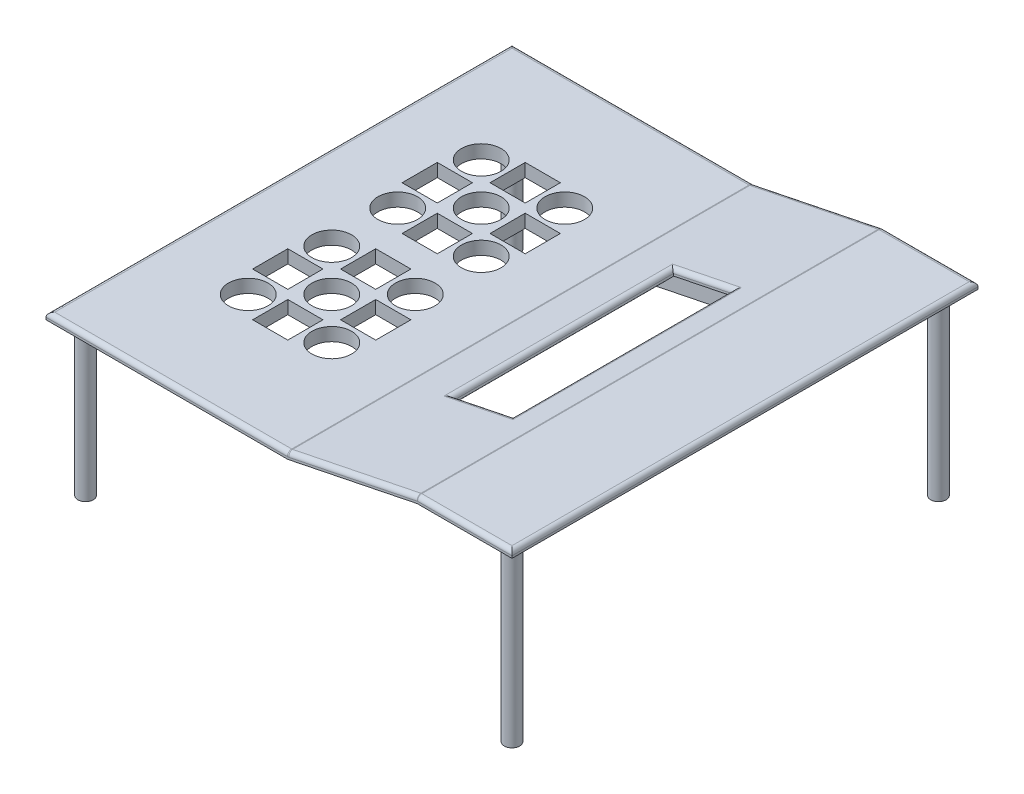
from build123d import *

# Parameters (mm, degrees)
EXTRUDE_1_DEPTH     = 106
SKETCH_4_R          = 1.75
EXTRUDE_2_DEPTH     = 34.6
SKETCH_5_R          = 1.75
EXTRUDE_3_DEPTH     = 40.6
SKETCH_8_W          = 30
SKETCH_8_H          = 60
EXTRUDE_4_DEPTH     = 3.5
SKETCH_9_W          = 26
SKETCH_9_H          = 51
CUT_EXTRUDE_1_DEPTH = 1.5
SKETCH_10_W         = 17
SKETCH_10_H         = 51
CUT_EXTRUDE_2_DEPTH = 2
CUT_EXTRUDE_4_REACH = 152.505
SKETCH_11_W         = 14
SKETCH_11_H         = 50
FILLET_3_R          = 1
FILLET_4_R          = 1
SKETCH_13_W         = 51
SKETCH_13_H         = 76
EXTRUDE_5_DEPTH     = 3.5
SKETCH_14_W         = 50
SKETCH_14_H         = 72
CUT_EXTRUDE_5_DEPTH = 2
CUT_EXTRUDE_7_REACH = 156.192
SKETCH_15_R         = 4.5
SKETCH_15_W         = 8
SKETCH_15_H         = 8


with BuildPart() as part:
    # 草图2 → 凸台-拉伸1 (new body)
    with BuildSketch(Plane.XY):
        Polygon((0, 0), (55, 0), (84.393876913, 6), (106, 6), (106, 4.5), (84.393876913, 4.5), (55, -1.5), (0, -1.5), align=None)
    extrude(amount=EXTRUDE_1_DEPTH)

    # 草图4 → 凸台-拉伸2 (add)
    with BuildSketch(Plane.XZ.offset(1.5)):
        with Locations(Location((4.5, 101.5, 0), (0, 0, 180))):
            Circle(SKETCH_4_R)
    extrude_2 = extrude(amount=EXTRUDE_2_DEPTH)

    # 草图5 → 凸台-拉伸3 (add)
    with BuildSketch(Plane.XZ.offset(-4.5)):
        with Locations(Location((101.5, 101.5, 0), (0, 0, 180))):
            Circle(SKETCH_5_R)
    extrude_3 = extrude(amount=EXTRUDE_3_DEPTH)

    # 镜向1: 凸台-拉伸2, 凸台-拉伸3 across plane
    add(extrude_2.mirror(Plane.XY.offset(53)))
    add(extrude_3.mirror(Plane.XY.offset(53)))

    # 草图8 → 凸台-拉伸4 (add)
    with BuildSketch(Plane(origin=(2.493938769, -12.217754868, 0), x_dir=(0.9797958971132713, 0.20000000000000007, 0), z_dir=(0.20000000000000007, -0.9797958971132713, 0))):
        with Locations((68.588774341, 53)):
            Rectangle(SKETCH_8_W, SKETCH_8_H)
    extrude(amount=EXTRUDE_4_DEPTH)

    # 草图9 → 切除-拉伸1 (cut)
    with BuildSketch(Plane(origin=(3.193938769, -15.647040508, 0), x_dir=(0.9797958971132713, 0.19999999999999998, 0), z_dir=(0.19999999999999998, -0.9797958971132713, 0))):
        with Locations((68.588774341, 53)):
            Rectangle(SKETCH_9_W, SKETCH_9_H)
    extrude(amount=-CUT_EXTRUDE_1_DEPTH, mode=Mode.SUBTRACT)

    # 草图10 → 切除-拉伸2 (cut)
    with BuildSketch(Plane(origin=(2.893938769, -14.177346662, 0), x_dir=(0.9797958971132713, 0.19999999999999998, 0), z_dir=(0.19999999999999998, -0.9797958971132713, 0))):
        with Locations((69.088774341, 53)):
            Rectangle(SKETCH_10_W, SKETCH_10_H)
    extrude(amount=-CUT_EXTRUDE_2_DEPTH, mode=Mode.SUBTRACT)

    # 草图11 → 切除-拉伸4 (cut, up to next)
    with BuildSketch(Plane(origin=(2.2, -10.777754868, 0), x_dir=(0.9797958971132713, 0.20000000000000007, 0), z_dir=(-0.20000000000000007, 0.9797958971132713, 0)), mode=Mode.PRIVATE) as cut_extrude_4_sk1:
        with Locations((70.588774341, -53)):
            Rectangle(SKETCH_11_W, SKETCH_11_H)
    cut_extrude_4_tool1 = extrude(cut_extrude_4_sk1.sketch, amount=-CUT_EXTRUDE_4_REACH, mode=Mode.PRIVATE) & part.part
    add(cut_extrude_4_tool1.solids().sort_by_distance((71.362591, 3.34, 53))[0], mode=Mode.SUBTRACT)

    # 圆角3
    fillet_3_edges = [part.edges().sort_by_distance(p)[0] for p in [
        (0, 0, 53),
        (55, 0, 53),
        (84.393876913, 6, 53),
        (106, 6, 53),
        (95.196938457, 6, 106),
        (69.696938457, 3, 106),
        (27.5, 0, 106),
        (27.5, 0, 0),
        (69.696938457, 3, 0),
        (95.196938457, 6, 0),
        (64.504020202, 1.94, 53),
        (71.362591482, 3.34, 78),
        (78.221162762, 4.74, 53),
        (71.362591482, 3.34, 28),
    ]]
    fillet(fillet_3_edges, radius=FILLET_3_R)

    # 圆角4
    fillet_4_edges = [part.edges().sort_by_distance(p)[0] for p in [
        (69.696938457, 1.5, 23),
        (69.696938457, 1.5, 83),
        (55.7, -4.92928564, 53),
        (70.396938457, -1.92928564, 23),
        (85.093876913, 1.07071436, 53),
        (70.396938457, -1.92928564, 83),
    ]]
    fillet(fillet_4_edges, radius=FILLET_4_R)

    # 草图13 → 凸台-拉伸5 (add)
    with BuildSketch(Plane.XZ.offset(1.5)):
        with Locations((27.5, 53)):
            Rectangle(SKETCH_13_W, SKETCH_13_H)
    extrude(amount=EXTRUDE_5_DEPTH)

    # 草图14 → 切除-拉伸5 (cut)
    with BuildSketch(Plane.XZ.offset(5)):
        with Locations((28, 53)):
            Rectangle(SKETCH_14_W, SKETCH_14_H)
    extrude(amount=-CUT_EXTRUDE_5_DEPTH, mode=Mode.SUBTRACT)

    # 草图15 → 切除-拉伸7 (cut, up to next)
    with BuildSketch(Plane(origin=(0, 0, 0), x_dir=(1, 0, 0), z_dir=(0, 1, 0)), mode=Mode.PRIVATE) as cut_extrude_7_sk1:
        with Locations(Location((29, -36, 0), (0, 0, 270))):
            Circle(SKETCH_15_R)
    cut_extrude_7_tool1 = extrude(cut_extrude_7_sk1.sketch, amount=-CUT_EXTRUDE_7_REACH, mode=Mode.PRIVATE) & part.part
    # 草图15 → 切除-拉伸7 (cut, up to next)
    with BuildSketch(Plane(origin=(0, 0, 0), x_dir=(1, 0, 0), z_dir=(0, 1, 0)), mode=Mode.PRIVATE) as cut_extrude_7_sk2:
        with Locations(Location((38.5, -26.5, 0), (0, 0, 270))):
            Circle(SKETCH_15_R)
    cut_extrude_7_tool2 = extrude(cut_extrude_7_sk2.sketch, amount=-CUT_EXTRUDE_7_REACH, mode=Mode.PRIVATE) & part.part
    # 草图15 → 切除-拉伸7 (cut, up to next)
    with BuildSketch(Plane(origin=(0, 0, 0), x_dir=(1, 0, 0), z_dir=(0, 1, 0)), mode=Mode.PRIVATE) as cut_extrude_7_sk3:
        with Locations(Location((38.5, -45.5, 0), (0, 0, 270))):
            Circle(SKETCH_15_R)
    cut_extrude_7_tool3 = extrude(cut_extrude_7_sk3.sketch, amount=-CUT_EXTRUDE_7_REACH, mode=Mode.PRIVATE) & part.part
    # 草图15 → 切除-拉伸7 (cut, up to next)
    with BuildSketch(Plane(origin=(0, 0, 0), x_dir=(1, 0, 0), z_dir=(0, 1, 0)), mode=Mode.PRIVATE) as cut_extrude_7_sk4:
        with Locations(Location((19.5, -26.5, 0), (0, 0, 270))):
            Circle(SKETCH_15_R)
    cut_extrude_7_tool4 = extrude(cut_extrude_7_sk4.sketch, amount=-CUT_EXTRUDE_7_REACH, mode=Mode.PRIVATE) & part.part
    # 草图15 → 切除-拉伸7 (cut, up to next)
    with BuildSketch(Plane(origin=(0, 0, 0), x_dir=(1, 0, 0), z_dir=(0, 1, 0)), mode=Mode.PRIVATE) as cut_extrude_7_sk5:
        with Locations(Location((19.5, -45.5, 0), (0, 0, 270))):
            Circle(SKETCH_15_R)
    cut_extrude_7_tool5 = extrude(cut_extrude_7_sk5.sketch, amount=-CUT_EXTRUDE_7_REACH, mode=Mode.PRIVATE) & part.part
    # 草图15 → 切除-拉伸7 (cut, up to next)
    with BuildSketch(Plane(origin=(0, 0, 0), x_dir=(1, 0, 0), z_dir=(0, 1, 0)), mode=Mode.PRIVATE) as cut_extrude_7_sk6:
        with Locations((39, -36)):
            Rectangle(SKETCH_15_W, SKETCH_15_H)
    cut_extrude_7_tool6 = extrude(cut_extrude_7_sk6.sketch, amount=-CUT_EXTRUDE_7_REACH, mode=Mode.PRIVATE) & part.part
    # 草图15 → 切除-拉伸7 (cut, up to next)
    with BuildSketch(Plane(origin=(0, 0, 0), x_dir=(1, 0, 0), z_dir=(0, 1, 0)), mode=Mode.PRIVATE) as cut_extrude_7_sk7:
        with Locations((29, -26)):
            Rectangle(SKETCH_15_W, SKETCH_15_H)
    cut_extrude_7_tool7 = extrude(cut_extrude_7_sk7.sketch, amount=-CUT_EXTRUDE_7_REACH, mode=Mode.PRIVATE) & part.part
    # 草图15 → 切除-拉伸7 (cut, up to next)
    with BuildSketch(Plane(origin=(0, 0, 0), x_dir=(1, 0, 0), z_dir=(0, 1, 0)), mode=Mode.PRIVATE) as cut_extrude_7_sk8:
        with Locations((29, -46)):
            Rectangle(SKETCH_15_W, SKETCH_15_H)
    cut_extrude_7_tool8 = extrude(cut_extrude_7_sk8.sketch, amount=-CUT_EXTRUDE_7_REACH, mode=Mode.PRIVATE) & part.part
    # 草图15 → 切除-拉伸7 (cut, up to next)
    with BuildSketch(Plane(origin=(0, 0, 0), x_dir=(1, 0, 0), z_dir=(0, 1, 0)), mode=Mode.PRIVATE) as cut_extrude_7_sk9:
        with Locations((19, -36)):
            Rectangle(SKETCH_15_W, SKETCH_15_H)
    cut_extrude_7_tool9 = extrude(cut_extrude_7_sk9.sketch, amount=-CUT_EXTRUDE_7_REACH, mode=Mode.PRIVATE) & part.part
    cut_extrude_7_1 = cut_extrude_7_tool1.solids().sort_by_distance((29, 0, 36))[0]
    add(cut_extrude_7_1, mode=Mode.SUBTRACT)
    cut_extrude_7_2 = cut_extrude_7_tool2.solids().sort_by_distance((38.5, 0, 26.5))[0]
    add(cut_extrude_7_2, mode=Mode.SUBTRACT)
    cut_extrude_7_3 = cut_extrude_7_tool3.solids().sort_by_distance((38.5, 0, 45.5))[0]
    add(cut_extrude_7_3, mode=Mode.SUBTRACT)
    cut_extrude_7_4 = cut_extrude_7_tool4.solids().sort_by_distance((19.5, 0, 26.5))[0]
    add(cut_extrude_7_4, mode=Mode.SUBTRACT)
    cut_extrude_7_5 = cut_extrude_7_tool5.solids().sort_by_distance((19.5, 0, 45.5))[0]
    add(cut_extrude_7_5, mode=Mode.SUBTRACT)
    cut_extrude_7_6 = cut_extrude_7_tool6.solids().sort_by_distance((39, 0, 36))[0]
    add(cut_extrude_7_6, mode=Mode.SUBTRACT)
    cut_extrude_7_7 = cut_extrude_7_tool7.solids().sort_by_distance((29, 0, 26))[0]
    add(cut_extrude_7_7, mode=Mode.SUBTRACT)
    cut_extrude_7_8 = cut_extrude_7_tool8.solids().sort_by_distance((29, 0, 46))[0]
    add(cut_extrude_7_8, mode=Mode.SUBTRACT)
    cut_extrude_7_9 = cut_extrude_7_tool9.solids().sort_by_distance((19, 0, 36))[0]
    add(cut_extrude_7_9, mode=Mode.SUBTRACT)
    cut_extrude_7 = cut_extrude_7_1 + cut_extrude_7_2 + cut_extrude_7_3 + cut_extrude_7_4 + cut_extrude_7_5 + cut_extrude_7_6 + cut_extrude_7_7 + cut_extrude_7_8 + cut_extrude_7_9  # 切除-拉伸7 as one shape, for the pattern or mirror that repeats it

    # 镜向2: 切除-拉伸7 across plane
    add(cut_extrude_7.mirror(Plane.XY.offset(53)), mode=Mode.SUBTRACT)


solid = part.part
